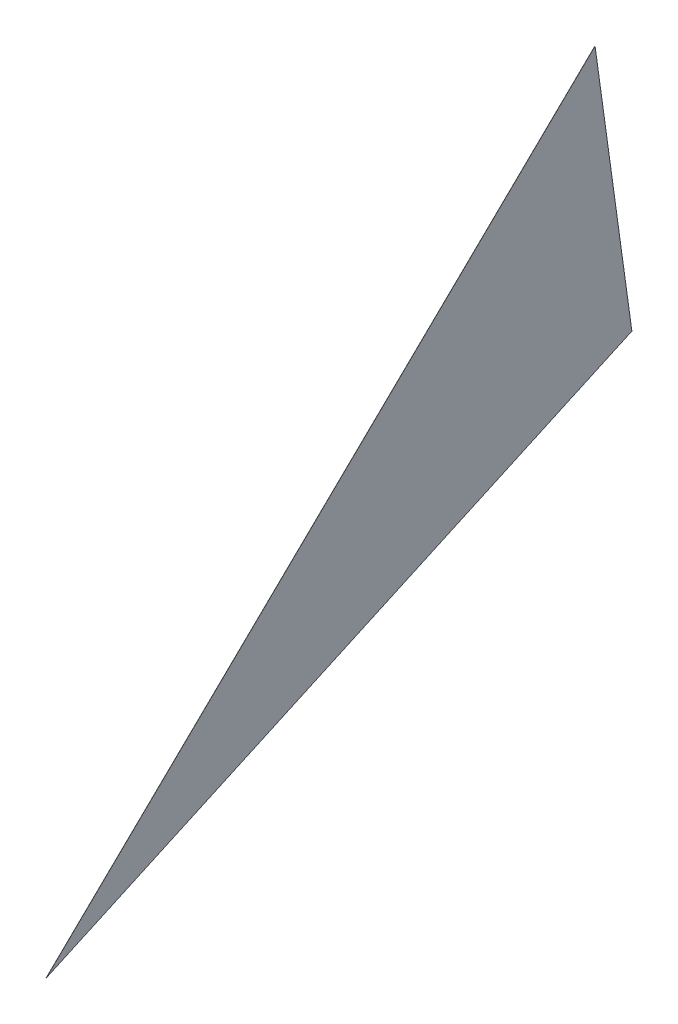
from build123d import *

# Parameters (mm, degrees)
BOSS_EXTRUDE1_DEPTH = 0.0254


with BuildPart() as part:
    # Sketch1 → Boss-Extrude1 (new body)
    with BuildSketch(Plane(origin=(0, 0, 0), x_dir=(0, 0, -1), z_dir=(1, 0, 0))):
        Polygon((0, 0), (115.526043743, 52.751618147), (108.264890069, 105.082258038), align=None)
    extrude(amount=BOSS_EXTRUDE1_DEPTH)


solid = part.part
